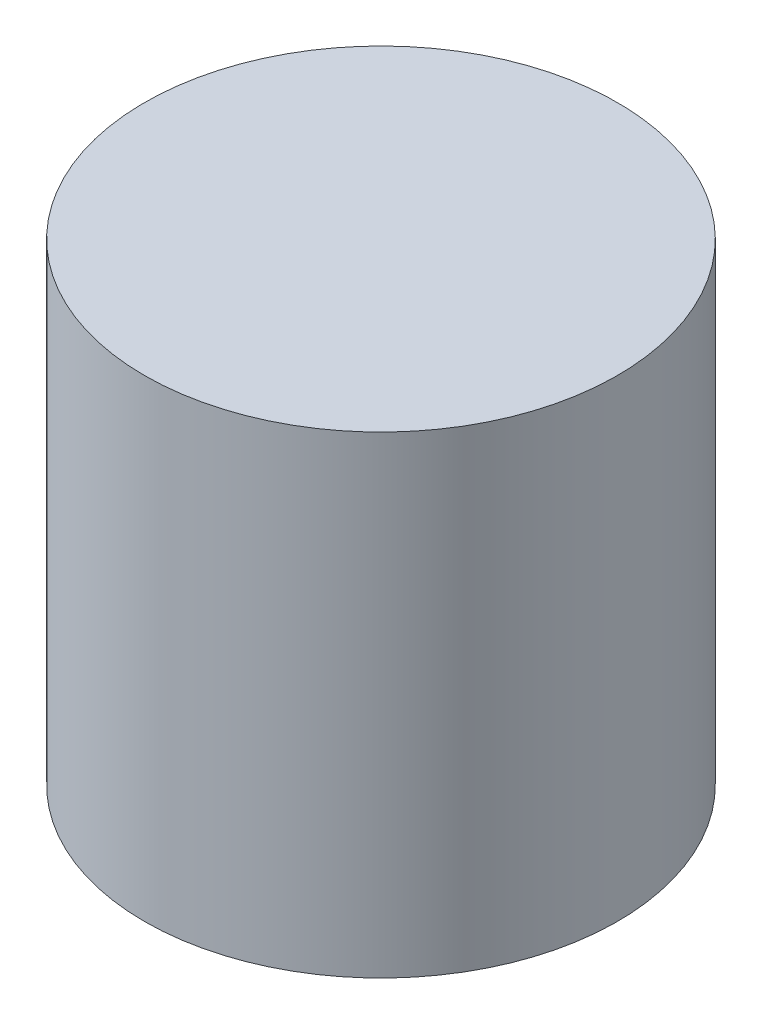
from build123d import *

# Parameters (mm, degrees)
SKETCH_2_R      = 50
EXTRUDE_1_DEPTH = 100


with BuildPart() as part:
    # 草图2 → 凸台-拉伸1 (new body)
    with BuildSketch(Plane(origin=(0, 0, 0), x_dir=(1, 0, 0), z_dir=(0, 1, 0))):
        with Locations(Location((0, 0, 0), (0, 0, 270))):
            Circle(SKETCH_2_R)
    extrude(amount=EXTRUDE_1_DEPTH)


solid = part.part
